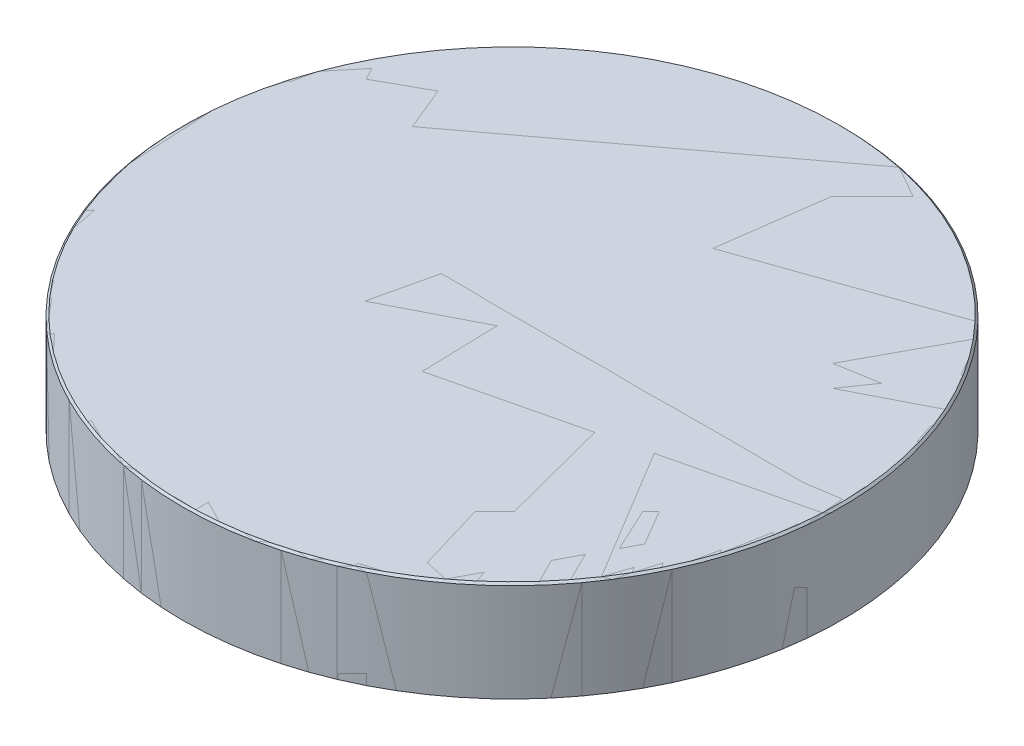
from build123d import *

# Parameters (mm, degrees)
SKETCH3_R           = 4.1783
BOSS_EXTRUDE1_DEPTH = 1.27
CHAMFER1_SIZE       = 0.0254
TEXT_2_W            = 0.0127
TEXT_2_H            = 0.508
CUT_EXTRUDE2_DEPTH  = 0.0254


with BuildPart() as part:
    # Sketch3 → Boss-Extrude1 (new body)
    with BuildSketch(Plane(origin=(0, 0, 0), x_dir=(1, 0, 0), z_dir=(0, 1, 0))):
        with Locations(Location((0, 0, 0), (0, 0, 270))):
            Circle(SKETCH3_R)
    extrude(amount=BOSS_EXTRUDE1_DEPTH)

    # Chamfer1
    chamfer1_edges = [part.edges().sort_by_distance(p)[0] for p in [
        (0, 1.27, -4.1783),
    ]]
    chamfer(chamfer1_edges, length=CHAMFER1_SIZE)

    # Text 2 → Cut-Extrude2 (cut)
    # profile 1 of 15: a face of its own
    with BuildSketch(Plane(origin=(0, 1.27, 0), x_dir=(1, 0, 0), z_dir=(0, 1, 0))):
        Polygon((-3.46075, 0.068857813), (-3.512145313, 0.018355469), (-3.58695625, -0.00635), (-3.685480469, -0.00635), (-3.759497656, 0.019446875), (-3.808710156, 0.067964844), (-3.799879688, 0.077192188), (-3.752552344, 0.030460156), (-3.683496094, 0.00635), (-3.588841406, 0.00635), (-3.518792969, 0.02936875), (-3.47345, 0.074910156), (-3.47345, 0.143073438), (-3.496567969, 0.189210156), (-3.519388281, 0.211534375), (-3.566120313, 0.235644531), (-3.710384375, 0.28336875), (-3.760092969, 0.307478906), (-3.785592188, 0.332878906), (-3.81, 0.382785938), (-3.81, 0.433685156), (-3.759497656, 0.483592188), (-3.685480469, 0.508), (-3.588047656, 0.508), (-3.514030469, 0.484882031), (-3.464421094, 0.436364063), (-3.47345, 0.427335156), (-3.520678125, 0.473670313), (-3.590032031, 0.4953), (-3.683297656, 0.4953), (-3.752353906, 0.472876563), (-3.7973, 0.428823438), (-3.7973, 0.385663281), (-3.775174219, 0.34051875), (-3.750270313, 0.315614844), (-3.703835938, 0.291504688), (-3.560067969, 0.243780469), (-3.510557813, 0.219670313), (-3.485455469, 0.194270313), (-3.46075, 0.1444625), align=None)
    # profile 2 of 15: a face of its own
    with BuildSketch(Plane(origin=(0, 1.27, 0), x_dir=(1, 0, 0), z_dir=(0, 1, 0))):
        Polygon((-2.880617969, 0.502939844), (-3.000474219, 0), (-3.013670313, -0.000396875), (-3.126184375, 0.476646875), (-3.239095313, -0.000297656), (-3.25199375, 0), (-3.37185, 0.502939844), (-3.35994375, 0.508198438), (-3.245445313, 0.02778125), (-3.131740625, 0.508), (-3.120429688, 0.508), (-3.007022656, 0.027384375), (-2.892425, 0.508198438), align=None)
    # profile 3 of 15: a face of its own
    with BuildSketch(Plane(origin=(0, 1.27, 0), x_dir=(1, 0, 0), z_dir=(0, 1, 0))):
        with Locations((-2.7305, 0.254)):
            Rectangle(TEXT_2_W, TEXT_2_H)
    # profile 4 of 15: a face of its own
    with BuildSketch(Plane(origin=(0, 1.27, 0), x_dir=(1, 0, 0), z_dir=(0, 1, 0))):
        Polygon((-2.1844, 0.358675781), (-2.211585938, 0.30876875), (-2.237680469, 0.283269531), (-2.311697656, 0.254), (-2.349797656, 0.254), (-2.1844, 0.002976563), (-2.197596094, -0.000297656), (-2.365077344, 0.254), (-2.52095, 0.254), (-2.52095, 0), (-2.53365, 0), (-2.53365, 0.508), (-2.311697656, 0.508), (-2.237680469, 0.484882031), (-2.211585938, 0.459779688), (-2.1844, 0.409575), align=None)
        Polygon((-2.1971, 0.362049219), (-2.1971, 0.406499219), (-2.223690625, 0.4556125), (-2.239863281, 0.47228125), (-2.313682031, 0.4953), (-2.52095, 0.4953), (-2.52095, 0.2667), (-2.314376563, 0.2667), (-2.244725, 0.294183594), (-2.222003906, 0.316309375), align=None, mode=Mode.SUBTRACT)
    # profile 5 of 15: a face of its own
    with BuildSketch(Plane(origin=(0, 1.27, 0), x_dir=(1, 0, 0), z_dir=(0, 1, 0))):
        Polygon((-1.749722656, -0.00635), (-2.0193, -0.00635), (-2.0193, 0.508), (-2.0066, 0.508), (-2.0066, 0.00635), (-1.749722656, 0.00635), align=None)
    # profile 6 of 15: a face of its own
    with BuildSketch(Plane(origin=(0, 1.27, 0), x_dir=(1, 0, 0), z_dir=(0, 1, 0))):
        with Locations((-1.1049, 0.254)):
            Rectangle(TEXT_2_W, TEXT_2_H)
    # profile 7 of 15: a face of its own
    with BuildSketch(Plane(origin=(0, 1.27, 0), x_dir=(1, 0, 0), z_dir=(0, 1, 0))):
        Polygon((-0.5588, 0), (-0.572889063, 0), (-0.89535, 0.486271094), (-0.89535, 0), (-0.90805, 0), (-0.90805, 0.508), (-0.895052344, 0.50879375), (-0.5715, 0.020736719), (-0.5715, 0.508), (-0.5588, 0.508), align=None)
    # profile 8 of 15: a face of its own
    with BuildSketch(Plane(origin=(0, 1.27, 0), x_dir=(1, 0, 0), z_dir=(0, 1, 0))):
        Polygon((-0.15875, 0.119558594), (-0.186432031, 0.045541406), (-0.211832031, 0.019446875), (-0.261739063, -0.00635), (-0.312638281, -0.00635), (-0.362545313, 0.019446875), (-0.388044531, 0.045541406), (-0.41275, 0.119558594), (-0.41275, 0.168076563), (-0.40005, 0.168076563), (-0.40005, 0.12144375), (-0.376932031, 0.052288281), (-0.35480625, 0.029666406), (-0.309661719, 0.00635), (-0.264616406, 0.00635), (-0.215403906, 0.031849219), (-0.19923125, 0.047525781), (-0.17145, 0.121741406), (-0.17145, 0.508), (-0.15875, 0.508), align=None)
    # profile 9 of 15: a face of its own
    with BuildSketch(Plane(origin=(0, 1.27, 0), x_dir=(1, 0, 0), z_dir=(0, 1, 0))):
        Polygon((0.342800781, -0.00635), (0.0254, -0.00635), (0.0254, 0.508), (0.342800781, 0.508), (0.342800781, 0.4953), (0.0381, 0.4953), (0.0381, 0.2667), (0.22225, 0.2667), (0.22225, 0.254), (0.0381, 0.254), (0.0381, 0.00635), (0.342800781, 0.00635), align=None)
    # profile 10 of 15: a face of its own
    with BuildSketch(Plane(origin=(0, 1.27, 0), x_dir=(1, 0, 0), z_dir=(0, 1, 0))):
        Polygon((0.846534375, 0.117574219), (0.822424219, 0.068659375), (0.773211719, 0.019446875), (0.723007031, -0.00635), (0.624185156, -0.00635), (0.574278125, 0.018553906), (0.524767969, 0.068064063), (0.500955469, 0.117871875), (0.47625, 0.191591406), (0.47625, 0.312142188), (0.501054687, 0.385067969), (0.524767969, 0.434379688), (0.574377344, 0.48339375), (0.624284375, 0.508), (0.723007031, 0.508), (0.773211719, 0.484882031), (0.822424219, 0.435669531), (0.846534375, 0.386754688), (0.835322656, 0.380603125), (0.811907031, 0.428228125), (0.765869531, 0.474166406), (0.720129687, 0.4953), (0.627757031, 0.4953), (0.581917969, 0.472479688), (0.53578125, 0.42624375), (0.511869531, 0.380305469), (0.48895, 0.310455469), (0.48895, 0.193476563), (0.5127625, 0.12303125), (0.536376562, 0.076398438), (0.581917969, 0.029467969), (0.627161719, 0.00635), (0.718244531, 0.00635), (0.763190625, 0.027285156), (0.81200625, 0.0762), (0.835421875, 0.123725781), align=None)
    # profile 11 of 15: a face of its own
    with BuildSketch(Plane(origin=(0, 1.27, 0), x_dir=(1, 0, 0), z_dir=(0, 1, 0))):
        Polygon((1.37795, 0.4953), (1.21285, 0.4953), (1.21285, 0), (1.20015, 0), (1.20015, 0.4953), (1.03505, 0.4953), (1.03505, 0.508), (1.37795, 0.508), align=None)
    # profile 12 of 15: a face of its own
    with BuildSketch(Plane(origin=(0, 1.27, 0), x_dir=(1, 0, 0), z_dir=(0, 1, 0))):
        Polygon((1.8669, 0.191591406), (1.843484375, 0.118169531), (1.819374219, 0.068659375), (1.770161719, 0.019446875), (1.719957031, -0.00635), (1.621135156, -0.00635), (1.571327344, 0.018355469), (1.521717969, 0.067567969), (1.498004687, 0.117078125), (1.4732, 0.190301563), (1.4732, 0.311348438), (1.498004687, 0.384571875), (1.521717969, 0.434082031), (1.571327344, 0.483294531), (1.621234375, 0.508), (1.719957031, 0.508), (1.770161719, 0.484882031), (1.819374219, 0.435669531), (1.843484375, 0.386060156), (1.8669, 0.3127375), align=None)
        Polygon((1.8542, 0.193575781), (1.8542, 0.311050781), (1.831776562, 0.381099219), (1.809055469, 0.427930469), (1.762819531, 0.474166406), (1.717079687, 0.4953), (1.624707031, 0.4953), (1.578867969, 0.472380469), (1.53273125, 0.425846875), (1.508819531, 0.379710156), (1.4859, 0.309661719), (1.4859, 0.191988281), (1.508621094, 0.121939844), (1.532334375, 0.075803125), (1.578173437, 0.029269531), (1.623615625, 0.00635), (1.715194531, 0.00635), (1.760339062, 0.027384375), (1.80895625, 0.076100781), (1.831677344, 0.122932031), align=None, mode=Mode.SUBTRACT)
    # profile 13 of 15: a face of its own
    with BuildSketch(Plane(origin=(0, 1.27, 0), x_dir=(1, 0, 0), z_dir=(0, 1, 0))):
        Polygon((2.3876, 0.358675781), (2.360414062, 0.30876875), (2.334319531, 0.283269531), (2.260302344, 0.254), (2.222202344, 0.254), (2.3876, 0.002976563), (2.374403906, -0.000297656), (2.206922656, 0.254), (2.05105, 0.254), (2.05105, 0), (2.03835, 0), (2.03835, 0.508), (2.260302344, 0.508), (2.334319531, 0.484882031), (2.360414062, 0.459779688), (2.3876, 0.409575), align=None)
        Polygon((2.3749, 0.362049219), (2.3749, 0.406499219), (2.348309375, 0.4556125), (2.332136719, 0.47228125), (2.258317969, 0.4953), (2.05105, 0.4953), (2.05105, 0.2667), (2.257623437, 0.2667), (2.327275, 0.294183594), (2.349996094, 0.316309375), align=None, mode=Mode.SUBTRACT)
    # profile 14 of 15: a face of its own
    with BuildSketch(Plane(origin=(0, 1.27, 0), x_dir=(1, 0, 0), z_dir=(0, 1, 0))):
        Polygon((3.390602344, 0.502344531), (3.199804688, 0), (3.188394531, 0), (2.9972, 0.502344531), (3.008411719, 0.508694531), (3.19405, 0.020835938), (3.379390625, 0.508694531), align=None)
    # profile 15 of 15: a face of its own
    with BuildSketch(Plane(origin=(0, 1.27, 0), x_dir=(1, 0, 0), z_dir=(0, 1, 0))):
        Polygon((3.6957, 0), (3.683, 0), (3.683, 0.4841875), (3.623865625, 0.426442188), (3.575248438, 0.401935156), (3.5687, 0.412849219), (3.616325, 0.436959375), (3.689250781, 0.508), (3.6957, 0.508), align=None)
    extrude(amount=-CUT_EXTRUDE2_DEPTH, mode=Mode.SUBTRACT)


with BuildPart() as body_2:
    # Spun Profile Sketch1 → Revolve 2 (revolve)
    with BuildSketch(Plane(origin=(0, 1.27, 0), x_dir=(0, 1, 0), z_dir=(1, 0, 0)), mode=Mode.PRIVATE) as revolve_2_sk:
        Polygon((-1.27, 0), (0, 0), (0, 4.1529), (-0.0254, 4.1783), (-1.27, 4.1783), align=None)
    revolve(revolve_2_sk.sketch.rotate(Axis((0, 1.27, 0), (0, 1, 0)), 180), axis=Axis((0, 1.27, 0), (0, 1, 0)))


solid = Compound([part.part, body_2.part])
